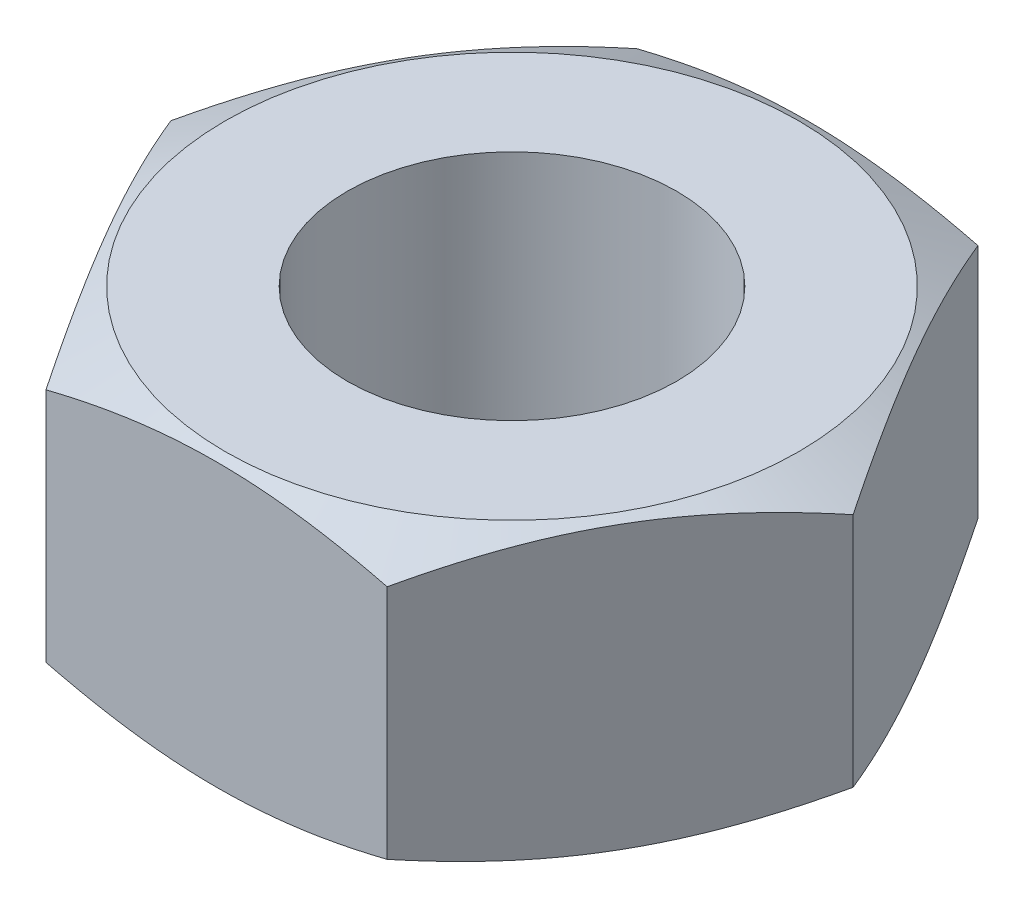
from build123d import *

# Parameters (mm, degrees)
CROQUIS1_R              = 3.0226
SALIENTE_EXTRUIR1_DEPTH = 5.334


with BuildPart() as part:
    # Croquis1 → Saliente-Extruir1 (new body)
    with BuildSketch(Plane(origin=(0, 0, 0), x_dir=(1, 0, 0), z_dir=(0, 1, 0))):
        Polygon((-6.26182555, 0), (-3.130912775, -5.4229), (3.130912775, -5.4229), (6.26182555, 0), (3.130912775, 5.4229), (-3.130912775, 5.4229), align=None)
        with Locations(Location((0, 0, 0), (0, 0, 270))):
            Circle(CROQUIS1_R, mode=Mode.SUBTRACT)
    extrude(amount=SALIENTE_EXTRUIR1_DEPTH)

    # Croquis2 → Cortar-Revolución1 (revolve, cut)
    with BuildSketch(Plane.XY, mode=Mode.PRIVATE) as cortar_revoluci_n1_sk:
        Polygon((-6.26182555, 5.334), (-6.26182555, 4.834), (-5.26182555, 5.334), align=None)
    revolve(cortar_revoluci_n1_sk.sketch.rotate(Axis((0, 0, 0), (0, 1, 0)), 270), axis=Axis((0, 0, 0), (0, 1, 0)), mode=Mode.SUBTRACT)

    # Croquis3 → Cortar-Revolución3 (revolve, cut)
    with BuildSketch(Plane.XY, mode=Mode.PRIVATE) as cortar_revoluci_n3_sk:
        Polygon((-6.26182555, 0), (-5.26182555, 0), (-6.26182555, 0.5), align=None)
    revolve(cortar_revoluci_n3_sk.sketch.rotate(Axis((0, 0, 0), (0, 1, 0)), 120.000000008), axis=Axis((0, 0, 0), (0, 1, 0)), mode=Mode.SUBTRACT)


solid = part.part
